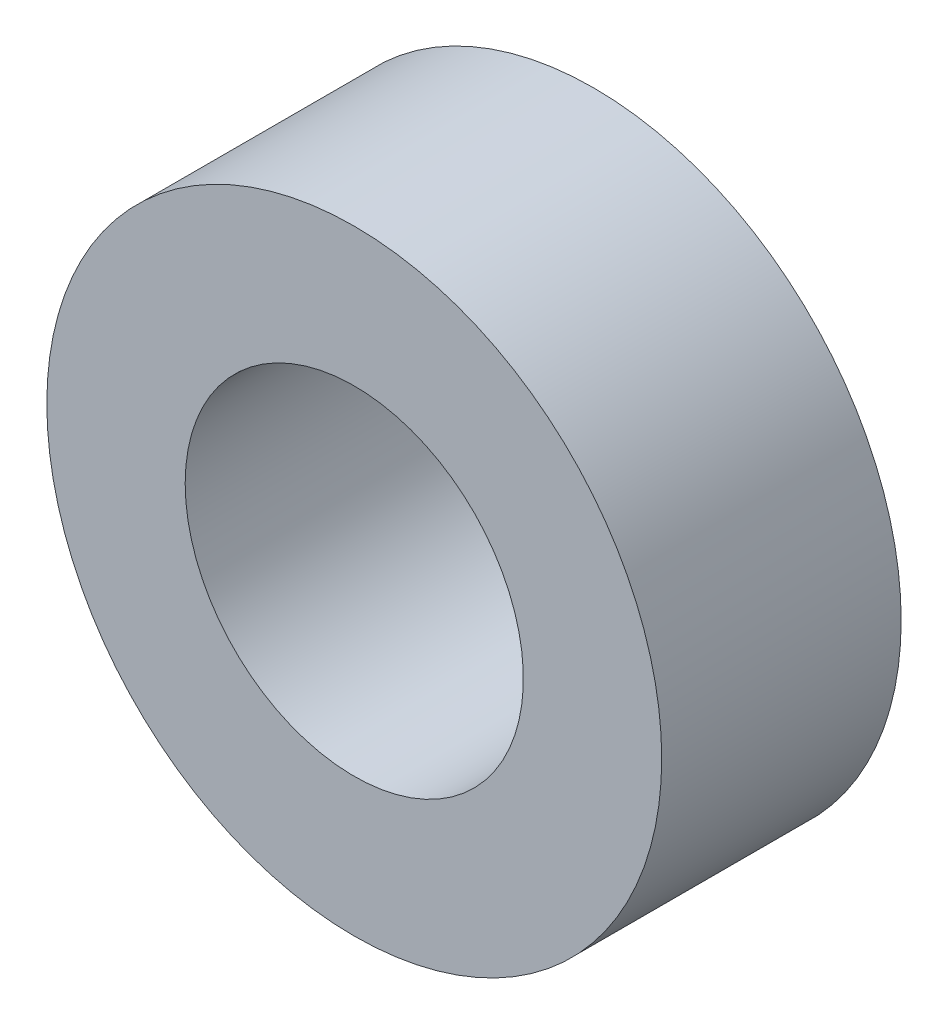
from build123d import *

# Parameters (mm, degrees)
SKETCH1_R           = 9.525
SKETCH1_R_2         = 5.23875
BOSS_EXTRUDE1_DEPTH = 3.709253313


with BuildPart() as part:
    # Sketch1 → Boss-Extrude1 (new, symmetric)
    with BuildSketch(Plane.XY):
        with Locations(Location((0, 0, 0), (0, 0, 180))):
            Circle(SKETCH1_R)
        with Locations(Location((0, 0, 0), (0, 0, 180))):
            Circle(SKETCH1_R_2, mode=Mode.SUBTRACT)
    extrude(amount=BOSS_EXTRUDE1_DEPTH, both=True)


solid = part.part
